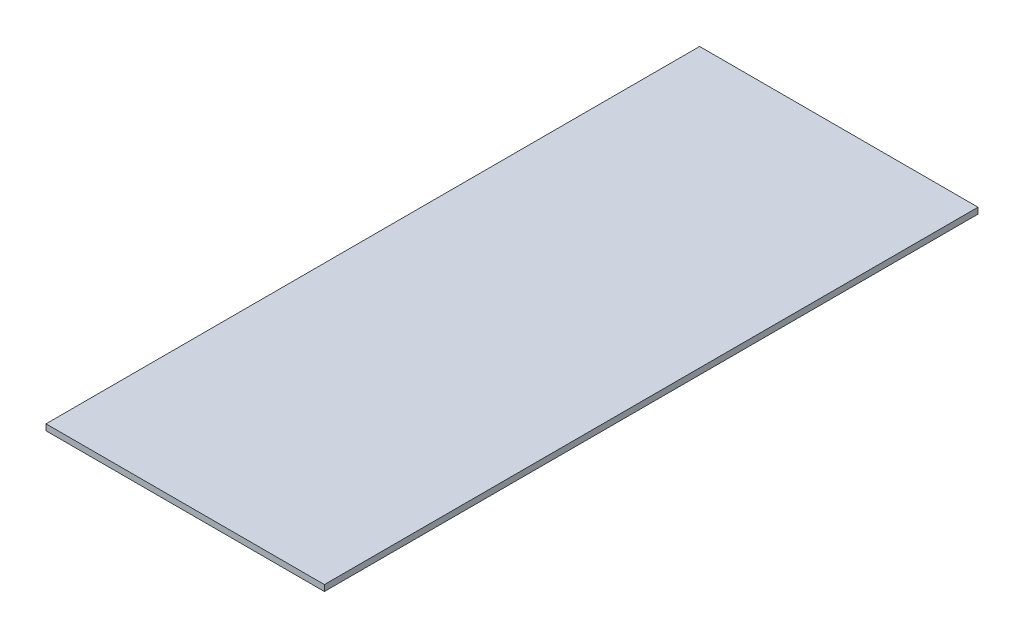
from build123d import *

# Parameters (mm, degrees)
SKETCH2_W           = 292.1
SKETCH2_H           = 685.8
BOSS_EXTRUDE1_DEPTH = 3.175


with BuildPart() as part:
    # Sketch2 → Boss-Extrude1 (new, symmetric)
    with BuildSketch(Plane(origin=(0, 0, 0), x_dir=(1, 0, 0), z_dir=(0, 1, 0))):
        Rectangle(SKETCH2_W, SKETCH2_H)
    extrude(amount=BOSS_EXTRUDE1_DEPTH, both=True)


solid = part.part
